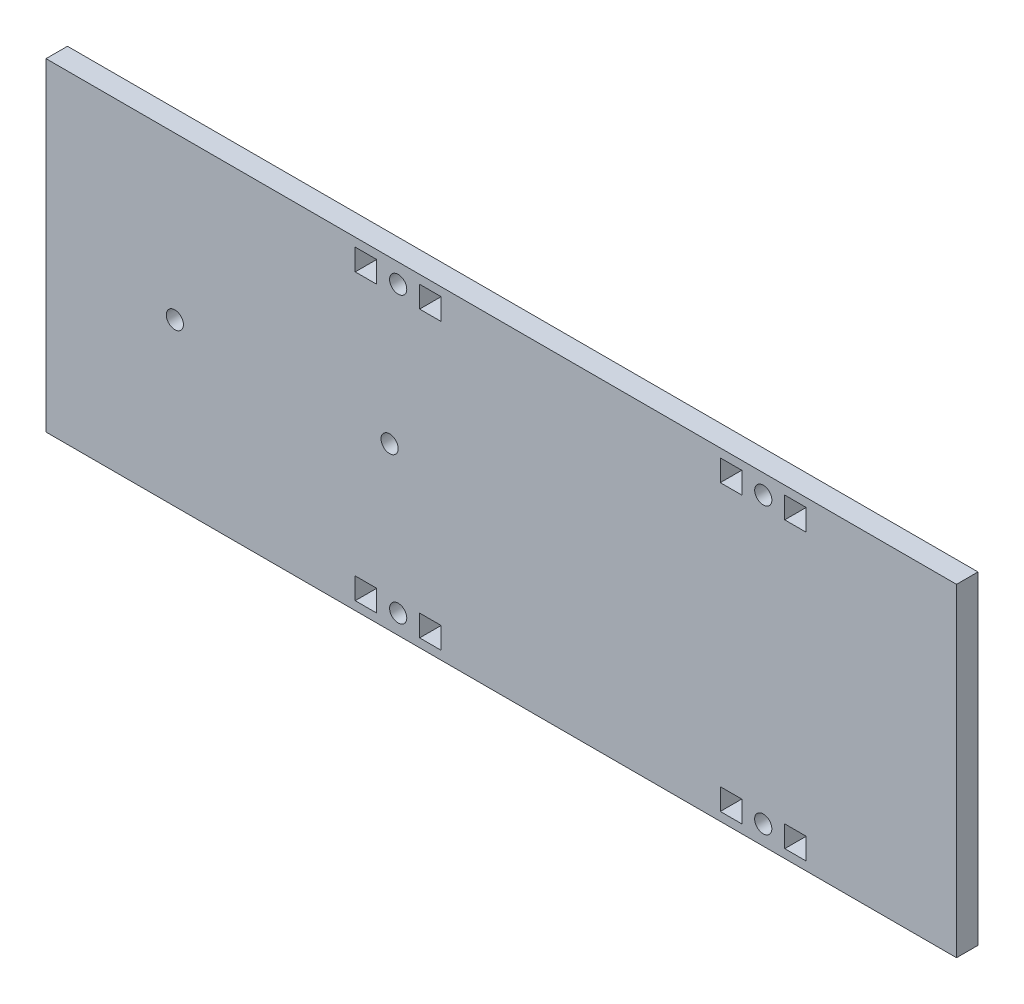
from build123d import *

# Parameters (mm, degrees)
ESQUISSE1_W        = 212
ESQUISSE1_H        = 75.3
ESQUISSE1_R        = 2
ESQUISSE1_W_2      = 5
ESQUISSE1_H_2      = 5
BOSS_EXTRU_1_DEPTH = 5


with BuildPart() as part:
    # Esquisse1 → Boss.-Extru.1 (new body)
    with BuildSketch(Plane.XY):
        with Locations((106, 0)):
            Rectangle(ESQUISSE1_W, ESQUISSE1_H)
        with Locations((30, 0)):
            Circle(ESQUISSE1_R, mode=Mode.SUBTRACT)
        with Locations((80, 0)):
            Circle(ESQUISSE1_R, mode=Mode.SUBTRACT)
        with Locations((82, 33.15)):
            Circle(ESQUISSE1_R, mode=Mode.SUBTRACT)
        with Locations((167, 33.15)):
            Circle(ESQUISSE1_R, mode=Mode.SUBTRACT)
        with Locations(Location((167, -33.15, 0), (0, 0, 90))):
            Circle(ESQUISSE1_R, mode=Mode.SUBTRACT)
        with Locations(Location((82, -33.15, 0), (0, 0, 90))):
            Circle(ESQUISSE1_R, mode=Mode.SUBTRACT)
        with Locations((74.5, 33.15)):
            Rectangle(ESQUISSE1_W_2, ESQUISSE1_H_2, mode=Mode.SUBTRACT)
        with Locations((89.5, 33.15)):
            Rectangle(ESQUISSE1_W_2, ESQUISSE1_H_2, mode=Mode.SUBTRACT)
        with Locations((159.5, 33.15)):
            Rectangle(ESQUISSE1_W_2, ESQUISSE1_H_2, mode=Mode.SUBTRACT)
        with Locations((174.5, 33.15)):
            Rectangle(ESQUISSE1_W_2, ESQUISSE1_H_2, mode=Mode.SUBTRACT)
        with Locations((159.5, -33.15)):
            Rectangle(ESQUISSE1_W_2, ESQUISSE1_H_2, mode=Mode.SUBTRACT)
        with Locations((174.5, -33.15)):
            Rectangle(ESQUISSE1_W_2, ESQUISSE1_H_2, mode=Mode.SUBTRACT)
        with Locations((74.5, -33.15)):
            Rectangle(ESQUISSE1_W_2, ESQUISSE1_H_2, mode=Mode.SUBTRACT)
        with Locations((89.5, -33.15)):
            Rectangle(ESQUISSE1_W_2, ESQUISSE1_H_2, mode=Mode.SUBTRACT)
    extrude(amount=BOSS_EXTRU_1_DEPTH)


solid = part.part
